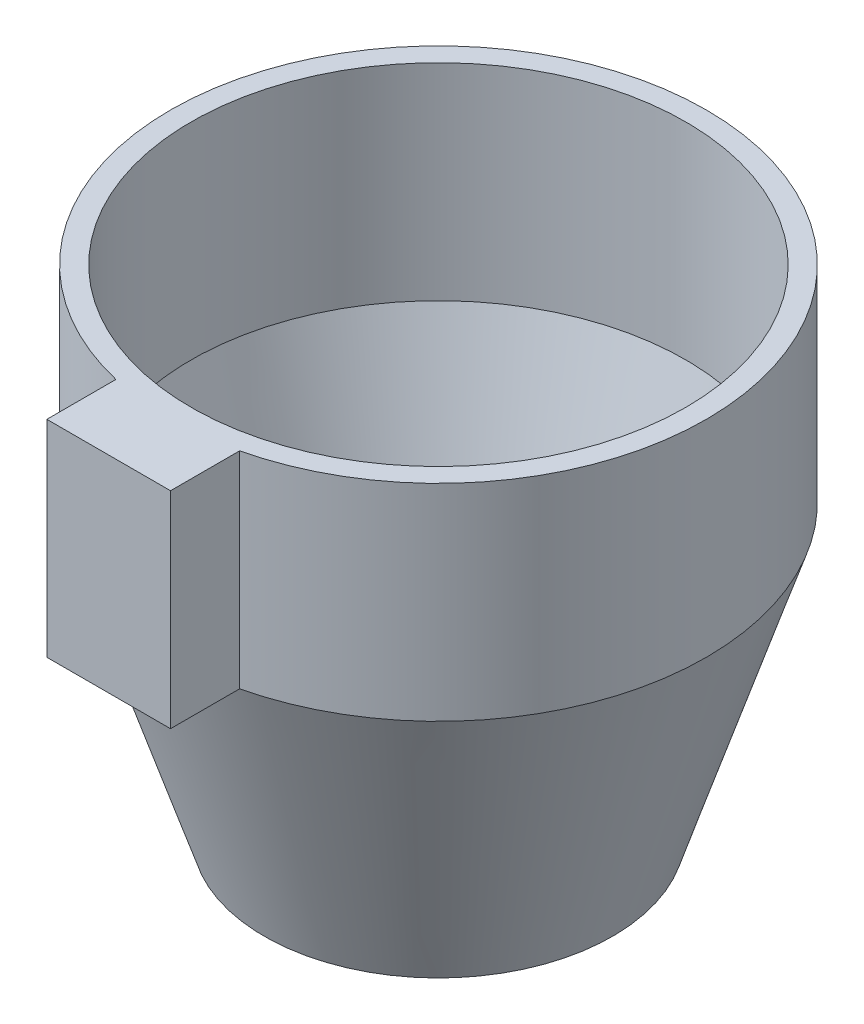
from build123d import *

# Parameters (mm, degrees)
SKETCH2_R           = 65
SKETCH2_R_2         = 60
EXTRUDE_THIN1_DEPTH = 50
SKETCH4_W           = 30
SKETCH4_H           = 20
BOSS_EXTRUDE1_DEPTH = 50


with BuildPart() as part:
    # Sketch2 → Extrude-Thin1 (new body)
    with BuildSketch(Plane(origin=(0, 0, 0), x_dir=(1, 0, 0), z_dir=(0, 1, 0))):
        Circle(SKETCH2_R)
        Circle(SKETCH2_R_2, mode=Mode.SUBTRACT)
    extrude(amount=EXTRUDE_THIN1_DEPTH)

    # Sketch3 → Revolve1 (revolve)
    with BuildSketch(Plane(origin=(0, 0, 0), x_dir=(0, 0, -1), z_dir=(1, 0, 0)), mode=Mode.PRIVATE) as revolve1_sk:
        Polygon((-65, 0), (-60, 0), (-37.255621264, -70), (-42.255621264, -70), align=None)
    revolve(revolve1_sk.sketch.rotate(Axis((0, 0, 0), (0, 1, 0)), 180), axis=Axis((0, 0, 0), (0, 1, 0)))

    # Sketch4 → Boss-Extrude1 (add)
    with BuildSketch(Plane(origin=(0, 0, 0), x_dir=(1, 0, 0), z_dir=(0, 1, 0))):
        with Locations((0, -70)):
            Rectangle(SKETCH4_W, SKETCH4_H)
    extrude(amount=BOSS_EXTRUDE1_DEPTH)


solid = part.part
